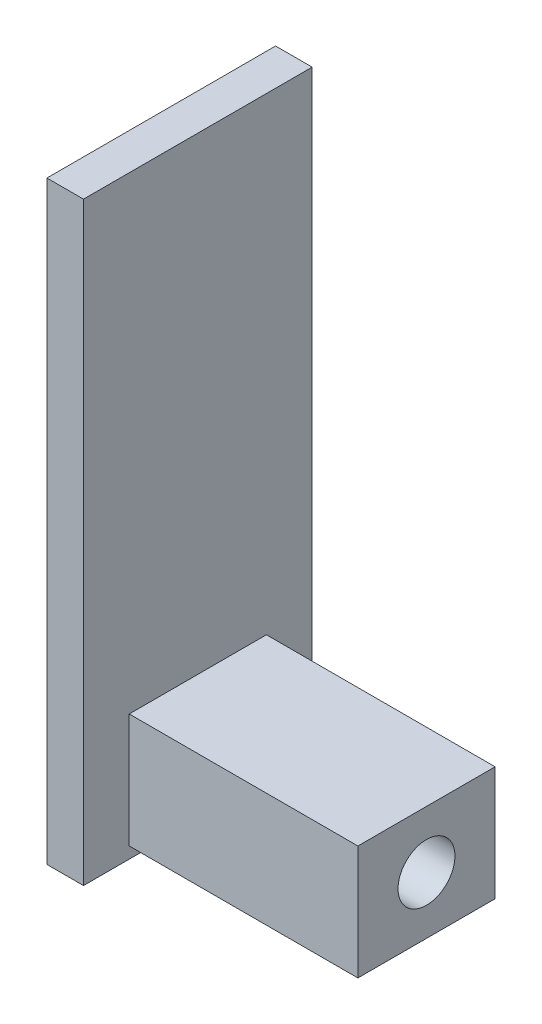
from build123d import *

# Parameters (mm, degrees)
SKETCH2_W               = 50
SKETCH2_H               = 130
BOSS_EXTRUDE2_DEPTH     = 8
CUT_EXTRUDE1_DEPTH      = 20
CUT_EXTRUDE1_DEPTH_BACK = 20
SKETCH4_R               = 11
SKETCH7_W               = 30
SKETCH7_H               = 25
BOSS_EXTRUDE3_DEPTH     = 50
SKETCH8_R               = 6.223
CUT_EXTRUDE2_DEPTH      = 50


with BuildPart() as part:
    # Sketch2 → Boss-Extrude2 (new body)
    with BuildSketch(Plane(origin=(0, 0, 0), x_dir=(0, 0, -1), z_dir=(1, 0, 0))):
        with Locations((25, 65)):
            Rectangle(SKETCH2_W, SKETCH2_H)
    extrude(amount=BOSS_EXTRUDE2_DEPTH)

    # Sketch4 → Cut-Extrude1 (cut, two sides: drawn at the far end of the back side and taken through both)
    with BuildSketch(Plane(origin=(0, 0, 0), x_dir=(0, 0, -1), z_dir=(1, 0, 0)).offset(-CUT_EXTRUDE1_DEPTH_BACK)):
        with Locations(Location((25, 15, 0), (0, 0, 180))):
            Circle(SKETCH4_R)
    extrude(amount=CUT_EXTRUDE1_DEPTH + CUT_EXTRUDE1_DEPTH_BACK, mode=Mode.SUBTRACT)

    # Sketch7 → Boss-Extrude3 (add)
    with BuildSketch(Plane(origin=(8, 0, 0), x_dir=(0, 0, -1), z_dir=(1, 0, 0))):
        with Locations((25, 15)):
            Rectangle(SKETCH7_W, SKETCH7_H)
    extrude(amount=BOSS_EXTRUDE3_DEPTH)

    # Sketch8 → Cut-Extrude2 (cut)
    with BuildSketch(Plane(origin=(58, 0, 0), x_dir=(0, 0, -1), z_dir=(1, 0, 0))):
        with Locations((25, 15)):
            Circle(SKETCH8_R)
    extrude(amount=-CUT_EXTRUDE2_DEPTH, mode=Mode.SUBTRACT)


solid = part.part
